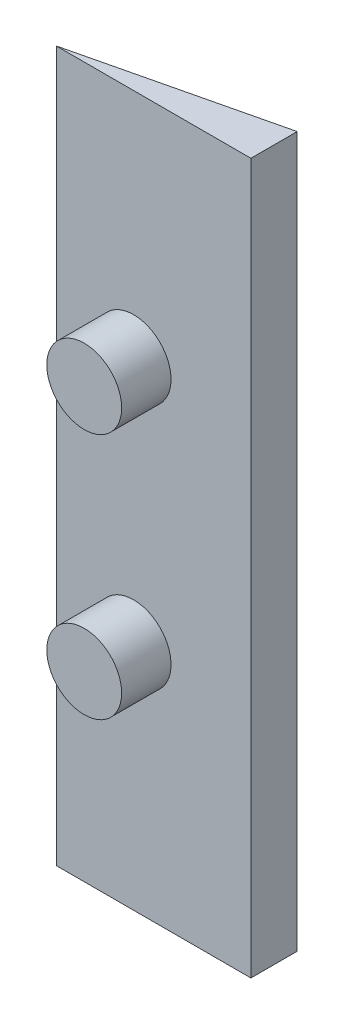
from build123d import *

# Parameters (mm, degrees)
BOSS_EXTRUDE1_DEPTH = 23
SKETCH2_R           = 2.425
BOSS_EXTRUDE2_DEPTH = 3.2


with BuildPart() as part:
    # Sketch1 → Boss-Extrude1 (new, symmetric)
    with BuildSketch(Plane(origin=(0, 0, 0), x_dir=(1, 0, 0), z_dir=(0, 1, 0))):
        Polygon((-6.3, 0), (6.3, 0), (6.3, 3), align=None)
    extrude(amount=BOSS_EXTRUDE1_DEPTH, both=True)

    # Sketch2 → Boss-Extrude2 (add)
    with BuildSketch(Plane.XY):
        with Locations(Location((-1.3, 8, 0), (0, 0, 180))):
            Circle(SKETCH2_R)
        with Locations(Location((-1.3, -8, 0), (0, 0, 180))):
            Circle(SKETCH2_R)
    extrude(amount=BOSS_EXTRUDE2_DEPTH)


solid = part.part
